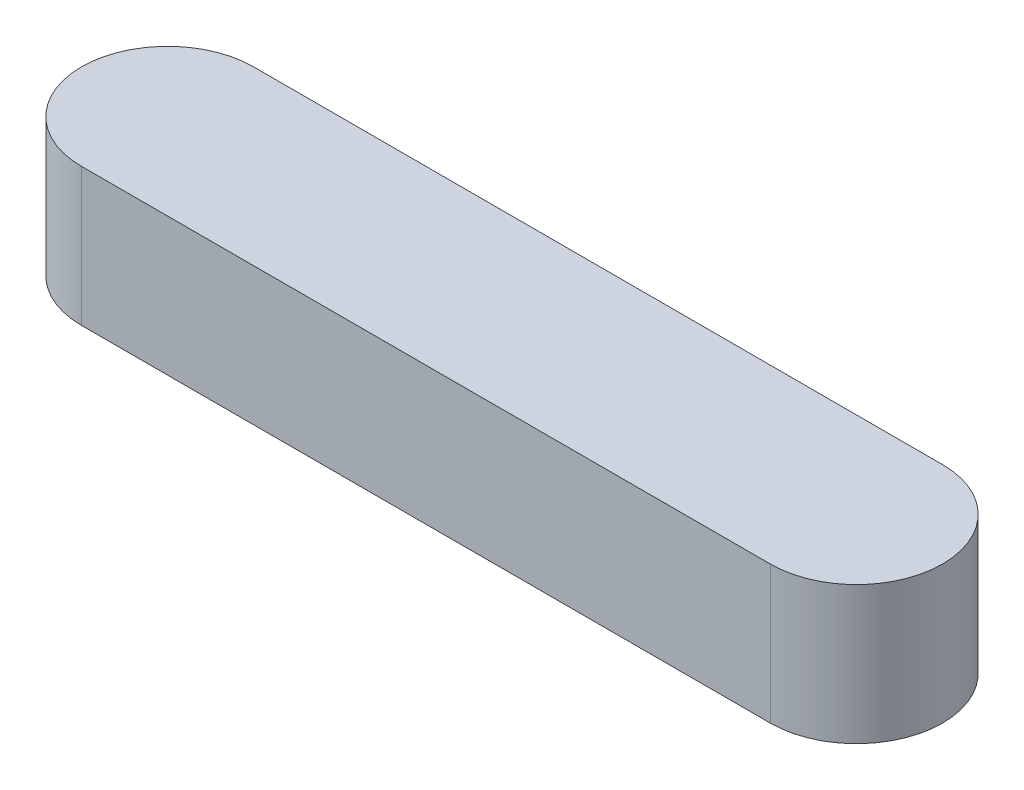
from build123d import *

# Parameters (mm, degrees)
BODY_DEPTH = 8


with BuildPart() as part:
    # Sketch4 → body (new body)
    with BuildSketch(Plane(origin=(0, 0, 0), x_dir=(1, 0, 0), z_dir=(0, 1, 0))):
        with BuildLine():
            Line((20, 5), (-20, 5))
            ThreePointArc((-20, 5), (-25, 0), (-20, -5))
            Line((-20, -5), (20, -5))
            ThreePointArc((20, -5), (25, 0), (20, 5))
        make_face()
    extrude(amount=BODY_DEPTH)


solid = part.part
